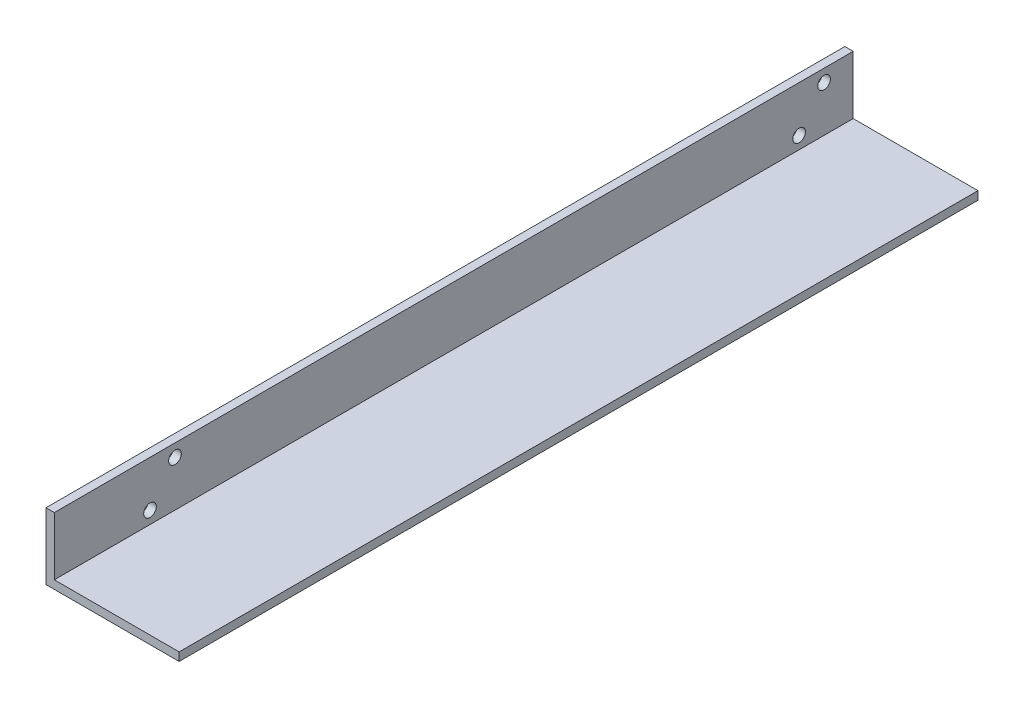
from build123d import *

# Parameters (mm, degrees)
BOSS_EXTRUDE1_DEPTH = 304.8
CUT_EXTRUDE1_REACH  = 312.047
SKETCH2_R           = 2.413


with BuildPart() as part:
    # Sketch1 → Boss-Extrude1 (new body)
    with BuildSketch(Plane.XY):
        Polygon((3.175, 3.175), (3.175, 25.4), (0, 25.4), (0, 0), (50.8, 0), (50.8, 3.175), align=None)
    extrude(amount=BOSS_EXTRUDE1_DEPTH)

    # Sketch2 → Cut-Extrude1 (cut, up to next)
    with BuildSketch(Plane.ZY, mode=Mode.PRIVATE) as cut_extrude1_sk1:
        with Locations((258.7625, 20.6375)):
            Circle(SKETCH2_R)
    cut_extrude1_tool1 = extrude(cut_extrude1_sk1.sketch, amount=-CUT_EXTRUDE1_REACH, mode=Mode.PRIVATE) & part.part
    # Sketch2 → Cut-Extrude1 (cut, up to next)
    with BuildSketch(Plane.ZY, mode=Mode.PRIVATE) as cut_extrude1_sk2:
        with Locations((268.2875, 7.9375)):
            Circle(SKETCH2_R)
    cut_extrude1_tool2 = extrude(cut_extrude1_sk2.sketch, amount=-CUT_EXTRUDE1_REACH, mode=Mode.PRIVATE) & part.part
    # Sketch2 → Cut-Extrude1 (cut, up to next)
    with BuildSketch(Plane.ZY, mode=Mode.PRIVATE) as cut_extrude1_sk3:
        with Locations((11.1125, 20.6375)):
            Circle(SKETCH2_R)
    cut_extrude1_tool3 = extrude(cut_extrude1_sk3.sketch, amount=-CUT_EXTRUDE1_REACH, mode=Mode.PRIVATE) & part.part
    # Sketch2 → Cut-Extrude1 (cut, up to next)
    with BuildSketch(Plane.ZY, mode=Mode.PRIVATE) as cut_extrude1_sk4:
        with Locations((20.6375, 7.9375)):
            Circle(SKETCH2_R)
    cut_extrude1_tool4 = extrude(cut_extrude1_sk4.sketch, amount=-CUT_EXTRUDE1_REACH, mode=Mode.PRIVATE) & part.part
    add(cut_extrude1_tool1.solids().sort_by_distance((0, 20.6375, 258.7625))[0], mode=Mode.SUBTRACT)
    add(cut_extrude1_tool2.solids().sort_by_distance((0, 7.9375, 268.2875))[0], mode=Mode.SUBTRACT)
    add(cut_extrude1_tool3.solids().sort_by_distance((0, 20.6375, 11.1125))[0], mode=Mode.SUBTRACT)
    add(cut_extrude1_tool4.solids().sort_by_distance((0, 7.9375, 20.6375))[0], mode=Mode.SUBTRACT)


solid = part.part
